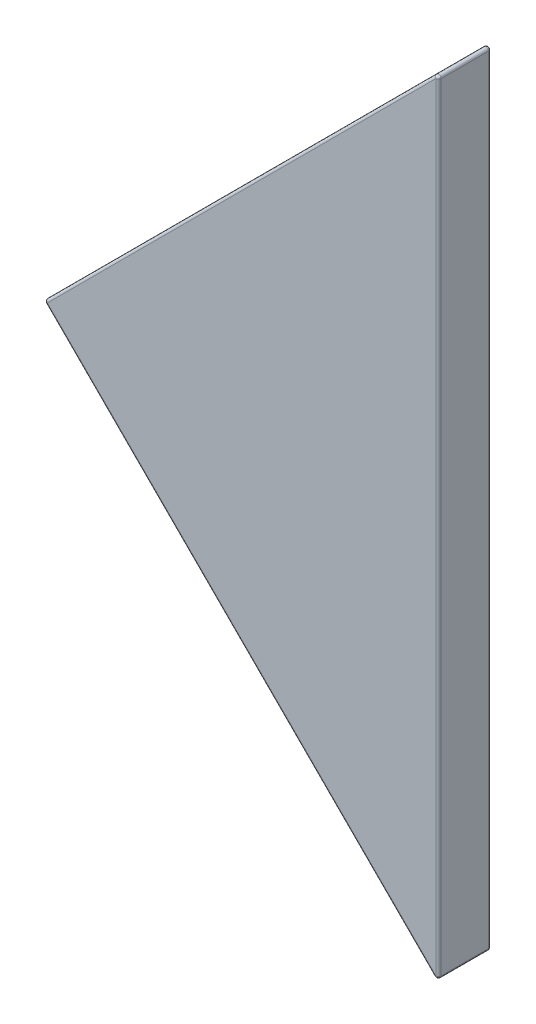
from build123d import *

# Parameters (mm, degrees)
EXTRUDE_1_DEPTH = 10
FILLET_1_R      = 0.5


with BuildPart() as part:
    # 草图1 → 凸台-拉伸1 (new body)
    with BuildSketch(Plane.XY):
        Polygon((0, 0), (0, 150), (-75, 75), align=None)
    extrude(amount=EXTRUDE_1_DEPTH)

    # 圆角1
    fillet_1_edges = [part.edges().sort_by_distance(p)[0] for p in [
        (0, 75, 10),
        (0, 75, 0),
        (-37.5, 112.5, 10),
        (-37.5, 37.5, 0),
        (-37.5, 112.5, 0),
        (0, 150, 5),
        (0, 0, 5),
        (-75, 75, 5),
        (-37.5, 37.5, 10),
    ]]
    fillet(fillet_1_edges, radius=FILLET_1_R)


solid = part.part
